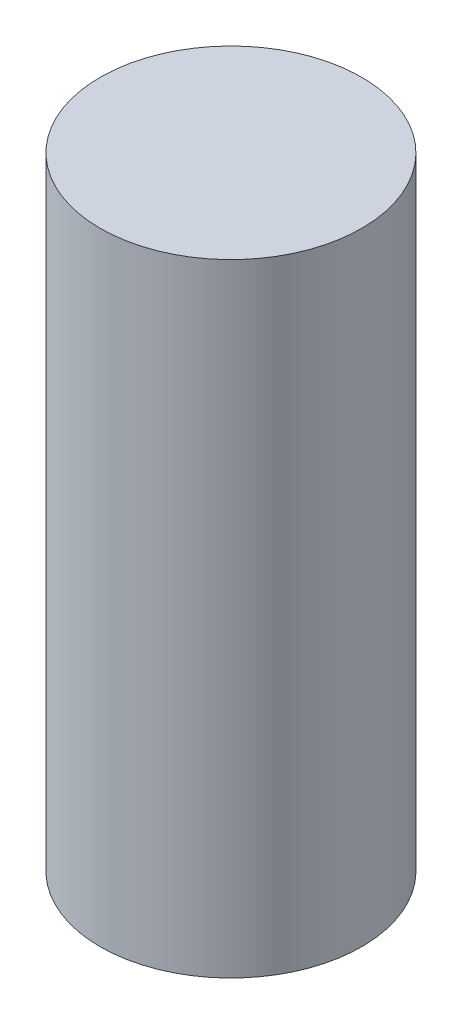
from build123d import *

# Parameters (mm, degrees)
SKETCH2_R           = 10.6807
BOSS_EXTRUDE1_DEPTH = 50.8


with BuildPart() as part:
    # Sketch2 → Boss-Extrude1 (new body)
    with BuildSketch(Plane(origin=(0, 0, 0), x_dir=(1, 0, 0), z_dir=(0, 1, 0))):
        with Locations(Location((0, 0, 0), (0, 0, 270))):
            Circle(SKETCH2_R)
    extrude(amount=BOSS_EXTRUDE1_DEPTH)


solid = part.part
